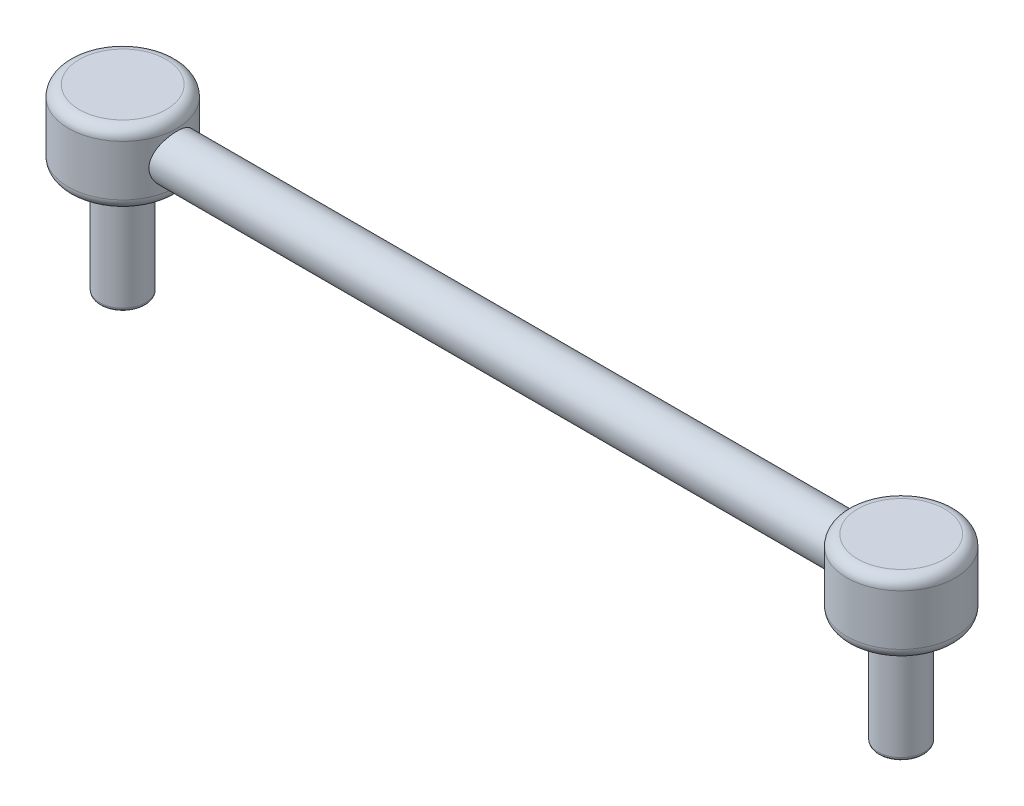
from build123d import *

# Parameters (mm, degrees)
SKETCH1_R           = 6.35
BOSS_EXTRUDE1_DEPTH = 30
SKETCH2_R           = 15
BOSS_EXTRUDE2_DEPTH = 20
SKETCH4_R           = 6.35
BOSS_EXTRUDE3_DEPTH = 30
SKETCH5_R           = 15
BOSS_EXTRUDE4_DEPTH = 20
SKETCH6_R           = 6.35
BOSS_EXTRUDE5_DEPTH = 215
FILLET1_R           = 3
FILLET2_R           = 1


with BuildPart() as part:
    # Sketch1 → Boss-Extrude1 (new body)
    with BuildSketch(Plane(origin=(0, 0, 0), x_dir=(1, 0, 0), z_dir=(0, 1, 0))):
        with Locations(Location((0, 0, 0), (0, 0, 270))):
            Circle(SKETCH1_R)
    extrude(amount=-BOSS_EXTRUDE1_DEPTH)

    # Sketch2 → Boss-Extrude2 (add)
    with BuildSketch(Plane(origin=(0, 0, 0), x_dir=(1, 0, 0), z_dir=(0, 1, 0))):
        with Locations(Location((0, 0, 0), (0, 0, 270))):
            Circle(SKETCH2_R)
    extrude(amount=BOSS_EXTRUDE2_DEPTH)



with BuildPart() as body_2:
    # Sketch4 → Boss-Extrude3 (new body)
    with BuildSketch(Plane(origin=(0, 0, 0), x_dir=(1, 0, 0), z_dir=(0, 1, 0))):
        with Locations(Location((215, 0, 0), (0, 0, 270))):
            Circle(SKETCH4_R)
    extrude(amount=-BOSS_EXTRUDE3_DEPTH)

    # Sketch5 → Boss-Extrude4 (add)
    with BuildSketch(Plane(origin=(0, 0, 0), x_dir=(1, 0, 0), z_dir=(0, 1, 0))):
        with Locations(Location((215, 0, 0), (0, 0, 270))):
            Circle(SKETCH5_R)
    extrude(amount=BOSS_EXTRUDE4_DEPTH)


with BuildPart() as part_1:
    add(part.part)

    add(body_2.part)  # Boss-Extrude5 merges body 2
    # Sketch6 → Boss-Extrude5 (add)
    with BuildSketch(Plane(origin=(0, 0, 0), x_dir=(0, 0, -1), z_dir=(1, 0, 0))):
        with Locations(Location((0, 10, 0), (0, 0, 180))):
            Circle(SKETCH6_R)
    extrude(amount=BOSS_EXTRUDE5_DEPTH)

    # Fillet1
    fillet1_edges = [part_1.edges().sort_by_distance(p)[0] for p in [
        (215, 0, -15),
        (215, 20, -15),
        (0, 0, -15),
        (0, 20, -15),
    ]]
    fillet(fillet1_edges, radius=FILLET1_R)

    # Fillet2
    fillet2_edges = [part_1.edges().sort_by_distance(p)[0] for p in [
        (215, -30, -6.35),
        (0, -30, -6.35),
    ]]
    fillet(fillet2_edges, radius=FILLET2_R)


solid = part_1.part
